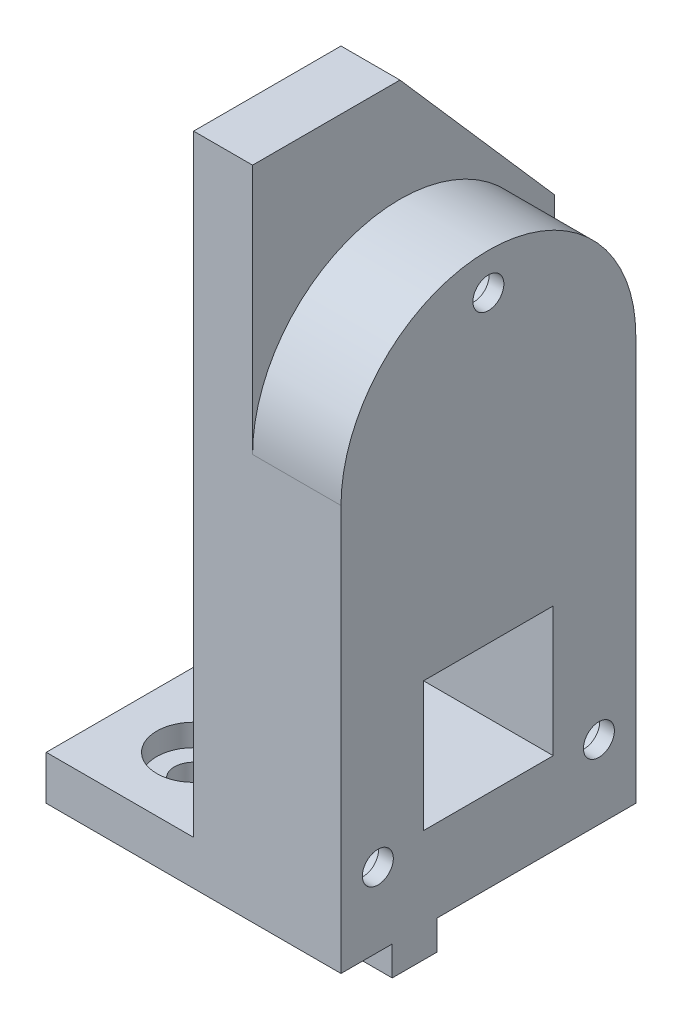
from build123d import *

# Parameters (mm, degrees)
SKETCH_1_W           = 20
SKETCH_1_H           = 60
SKETCH_1_R           = 2.6
EXTRUDE_1_DEPTH      = 6
SKETCH_2_W           = 6.1
SKETCH_2_H           = 43.9
SKETCH_2_H_2         = 1.95
SKETCH_2_W_2         = 6.043917029
EXTRUDE_2_DEPTH      = 4
SKETCH_3_R           = 4.9
CUT_EXTRUDE_3_DEPTH  = 3
SKETCH_4_W           = 20
SKETCH_4_H           = 40
EXTRUDE_3_DEPTH      = 69
CUT_EXTRUDE_4_DEPTH  = 75
SKETCH_6_R           = 2.1
CUT_EXTRUDE_5_DEPTH  = 75
CUT_EXTRUDE_6_DEPTH  = 75
SKETCH_13_R          = 3.5
CUT_EXTRUDE_8_DEPTH  = 3
SKETCH_14_R          = 3.5
CUT_EXTRUDE_9_DEPTH  = 3
SKETCH_15_W          = 6.1
SKETCH_15_H          = 1.95
SKETCH_15_W_2        = 6.043917029
CUT_EXTRUDE_10_DEPTH = 4
SKETCH_24_R          = 3.5
CUT_EXTRUDE_14_DEPTH = 15
SKETCH_25_R          = 3.5
CUT_EXTRUDE_15_DEPTH = 15
SKETCH_26_W          = 6.1
SKETCH_26_H          = 43.9
CUT_EXTRUDE_16_DEPTH = 4
SKETCH_27_W          = 20
SKETCH_27_H          = 10
CUT_EXTRUDE_17_DEPTH = 10
EXTRUDE_4_DEPTH      = 4
SKETCH_29_R          = 3.5
CUT_EXTRUDE_18_DEPTH = 18
EXTRUDE_5_DEPTH      = 8
SKETCH_31_W          = 20
SKETCH_31_H          = 20
EXTRUDE_6_DEPTH      = 3
CUT_EXTRUDE_19_DEPTH = 6
SKETCH_33_W          = 20
SKETCH_33_H          = 20
SKETCH_33_R          = 5
EXTRUDE_7_DEPTH      = 3


with BuildPart() as part:
    # 草图1 → 凸台-拉伸1 (new body)
    with BuildSketch(Plane(origin=(0, 0, 0), x_dir=(1, 0, 0), z_dir=(0, 1, 0))):
        Rectangle(SKETCH_1_W, SKETCH_1_H)
        with Locations(Location((0, 25, 0), (0, 0, 270))):
            Circle(SKETCH_1_R, mode=Mode.SUBTRACT)
        with Locations(Location((0, -25, 0), (0, 0, 270))):
            Circle(SKETCH_1_R, mode=Mode.SUBTRACT)
    extrude(amount=EXTRUDE_1_DEPTH)

    # 草图2 → 凸台-拉伸2 (add)
    with BuildSketch(Plane.XZ):
        Rectangle(SKETCH_2_W, SKETCH_2_H)
        with Locations((0, 29.025)):
            Rectangle(SKETCH_2_W, SKETCH_2_H_2)
        with Locations((0.028041485, -29.025)):
            Rectangle(SKETCH_2_W_2, SKETCH_2_H_2)
    extrude(amount=EXTRUDE_2_DEPTH)

    # 草图3 → 切除-拉伸3 (cut)
    with BuildSketch(Plane(origin=(0, 6, 0), x_dir=(1, 0, 0), z_dir=(0, 1, 0))):
        with Locations(Location((0, -25, 0), (0, 0, 270))):
            Circle(SKETCH_3_R)
        with Locations(Location((0, 25, 0), (0, 0, 270))):
            Circle(SKETCH_3_R)
    extrude(amount=-CUT_EXTRUDE_3_DEPTH, mode=Mode.SUBTRACT)

    # 草图4 → 凸台-拉伸3 (add)
    with BuildSketch(Plane(origin=(0, 6, 0), x_dir=(1, 0, 0), z_dir=(0, 1, 0))):
        Rectangle(SKETCH_4_W, SKETCH_4_H)
    extrude(amount=EXTRUDE_3_DEPTH)

    # 草图5 → 切除-拉伸4 (cut)
    with BuildSketch(Plane.ZY.offset(10)):
        Polygon((-8.8, 11.2), (0, 11.2), (8.8, 11.2), (8.8, 28.8), (0, 28.8), (-8.8, 28.8), align=None)
    extrude(amount=-CUT_EXTRUDE_4_DEPTH, mode=Mode.SUBTRACT)

    # 草图6 → 切除-拉伸5 (cut)
    with BuildSketch(Plane.ZY.offset(10)):
        with Locations((0, 70)):
            Circle(SKETCH_6_R)
        with Locations((-15, 10)):
            Circle(SKETCH_6_R)
        with Locations((15, 10)):
            Circle(SKETCH_6_R)
    extrude(amount=-CUT_EXTRUDE_5_DEPTH, mode=Mode.SUBTRACT)

    # 草图7 → 切除-拉伸6 (cut)
    with BuildSketch(Plane.ZY.offset(10)):
        with BuildLine():
            Line((-20, 75), (-20, 55))
            ThreePointArc((-20, 55), (-14.142135624, 69.142135624), (0, 75))
            Line((0, 75), (-20, 75))
        make_face()
        with BuildLine():
            Line((20, 75), (0, 75))
            ThreePointArc((0, 75), (14.142135624, 69.142135624), (20, 55))
            Line((20, 55), (20, 75))
        make_face()
    extrude(amount=-CUT_EXTRUDE_6_DEPTH, mode=Mode.SUBTRACT)

    # 草图13 → 切除-拉伸8 (cut)
    with BuildSketch(Plane.ZY.offset(10)):
        with Locations((-15, 10)):
            Circle(SKETCH_13_R)
        with Locations((15, 10)):
            Circle(SKETCH_13_R)
    extrude(amount=-CUT_EXTRUDE_8_DEPTH, mode=Mode.SUBTRACT)

    # 草图14 → 切除-拉伸9 (cut)
    with BuildSketch(Plane.ZY.offset(-5)):
        with Locations(Location((0, 70, 0), (0, 0, 270))):
            Circle(SKETCH_14_R)
    extrude(amount=-CUT_EXTRUDE_9_DEPTH, mode=Mode.SUBTRACT)

    # 草图15 → 切除-拉伸10 (cut)
    with BuildSketch(Plane(origin=(0, -4, 0), x_dir=(-1, 0, 0), z_dir=(0, -1, 0))):
        with Locations((0, -29.025)):
            Rectangle(SKETCH_15_W, SKETCH_15_H)
        with Locations((-0.028041485, 29.025)):
            Rectangle(SKETCH_15_W_2, SKETCH_15_H)
    extrude(amount=-CUT_EXTRUDE_10_DEPTH, mode=Mode.SUBTRACT)

    # 草图24 → 切除-拉伸14 (cut)
    with BuildSketch(Plane.ZY.offset(10)):
        with Locations((-15, 10)):
            Circle(SKETCH_24_R)
        with Locations((15, 10)):
            Circle(SKETCH_24_R)
    extrude(amount=-CUT_EXTRUDE_14_DEPTH, mode=Mode.SUBTRACT)

    # 草图25 → 切除-拉伸15 (cut)
    with BuildSketch(Plane.ZY.offset(10)):
        with Locations(Location((0, 70, 0), (0, 0, 270))):
            Circle(SKETCH_25_R)
    extrude(amount=-CUT_EXTRUDE_15_DEPTH, mode=Mode.SUBTRACT)

    # 草图26 → 切除-拉伸16 (cut)
    with BuildSketch(Plane(origin=(0, -4, 0), x_dir=(-1, 0, 0), z_dir=(0, -1, 0))):
        Rectangle(SKETCH_26_W, SKETCH_26_H)
    extrude(amount=-CUT_EXTRUDE_16_DEPTH, mode=Mode.SUBTRACT)

    # 草图27 → 切除-拉伸17 (cut)
    with BuildSketch(Plane(origin=(0, 6, 0), x_dir=(1, 0, 0), z_dir=(0, 1, 0))):
        with Locations((0, 25)):
            Rectangle(SKETCH_27_W, SKETCH_27_H)
        with Locations((0, -25)):
            Rectangle(SKETCH_27_W, SKETCH_27_H)
    extrude(amount=-CUT_EXTRUDE_17_DEPTH, mode=Mode.SUBTRACT)

    # 草图28 → 凸台-拉伸4 (add)
    with BuildSketch(Plane.XZ):
        Polygon((10, 6.95), (10, 10), (10, 13.05), (-10, 13.05), (-10, 10), (-10, 6.95), align=None)
    extrude(amount=EXTRUDE_4_DEPTH)

    # 草图29 → 切除-拉伸18 (cut)
    with BuildSketch(Plane.ZY.offset(10)):
        with Locations(Location((0, 70, 0), (0, 0, 270))):
            Circle(SKETCH_29_R)
        with Locations((15, 10)):
            Circle(SKETCH_29_R)
        with Locations((-15, 10)):
            Circle(SKETCH_29_R)
    extrude(amount=-CUT_EXTRUDE_18_DEPTH, mode=Mode.SUBTRACT)

    # 草图30 → 凸台-拉伸5 (add)
    with BuildSketch(Plane.ZY.offset(10)):
        with BuildLine():
            Line((20, 55), (20, 89))
            Line((20, 89), (0, 89))
            Line((0, 89), (-21, 65))
            Line((-21, 65), (-21, 0))
            Line((-21, 0), (-20, 0))
            Line((-20, 0), (-20, 55))
            ThreePointArc((-20, 55), (0, 75), (20, 55))
        make_face()
    extrude(amount=-EXTRUDE_5_DEPTH)

    # 草图31 → 凸台-拉伸6 (add)
    with BuildSketch(Plane.XZ):
        with Locations((-20, 10)):
            Rectangle(SKETCH_31_W, SKETCH_31_H)
    extrude(amount=-EXTRUDE_6_DEPTH)

    # 草图32 → 切除-拉伸19 (cut)
    with BuildSketch(Plane(origin=(0, 0, 0), x_dir=(-1, 0, 0), z_dir=(0, -1, 0))):
        with BuildLine():
            ThreePointArc((18.161522369, -8.161522369), (18.161522369, -11.838477631), (21.838477631, -11.838477631))
            Line((21.838477631, -11.838477631), (18.161522369, -8.161522369))
        make_face()
        with BuildLine():
            Line((18.161522369, -8.161522369), (21.838477631, -11.838477631))
            ThreePointArc((21.838477631, -11.838477631), (22.402086785, -10.994976924), (22.6, -10))
            ThreePointArc((22.6, -10), (20.994976924, -7.597913215), (18.161522369, -8.161522369))
        make_face()
    extrude(amount=-CUT_EXTRUDE_19_DEPTH, mode=Mode.SUBTRACT)

    # 草图33 → 凸台-拉伸7 (add)
    with BuildSketch(Plane(origin=(0, 3, 0), x_dir=(1, 0, 0), z_dir=(0, 1, 0))):
        with Locations((-20, -10)):
            Rectangle(SKETCH_33_W, SKETCH_33_H)
        with Locations(Location((-20, -10, 0), (0, 0, 270))):
            Circle(SKETCH_33_R, mode=Mode.SUBTRACT)
    extrude(amount=EXTRUDE_7_DEPTH)


solid = part.part
